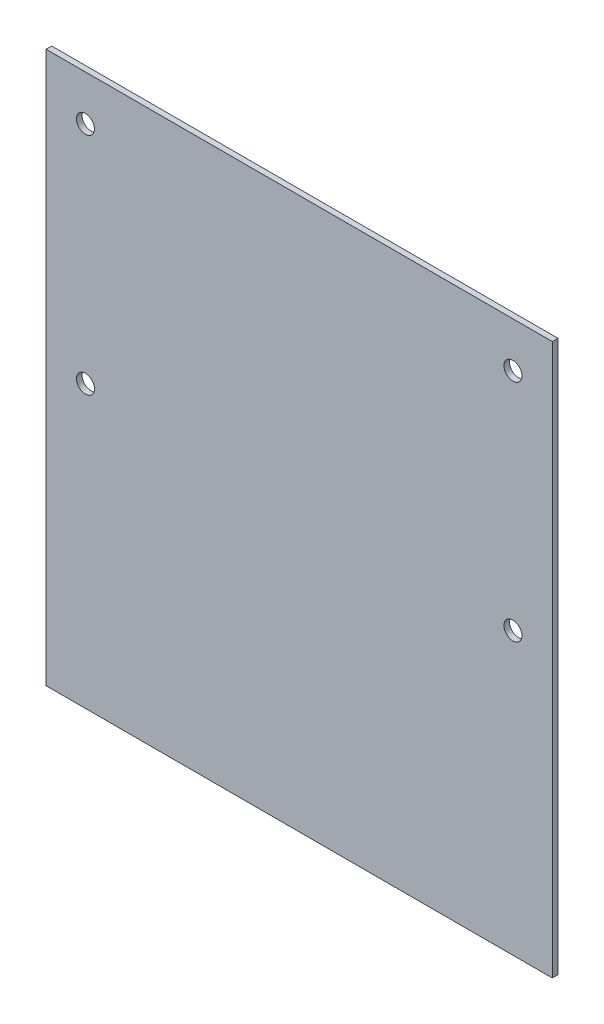
from build123d import *

# Parameters (mm, degrees)
ESQUISSE1_W                  = 90
ESQUISSE1_H                  = 98
BOSS_EXTRU_1_DEPTH           = 1
ENL_V_MAT_EXTRU_1_DEPTH      = 134.06013678
ENL_V_MAT_EXTRU_1_DEPTH_BACK = 134.06013678
ESQUISSE2_R                  = 1.6


with BuildPart() as part:
    # Esquisse1 → Boss.-Extru.1 (new body)
    with BuildSketch(Plane.XY):
        with Locations((45, 49)):
            Rectangle(ESQUISSE1_W, ESQUISSE1_H)
    extrude(amount=BOSS_EXTRU_1_DEPTH)

    # Esquisse2 → Enlèv. mat.-Extru.1 (cut, two sides: drawn at the far end of the back side and taken through both)
    with BuildSketch(Plane.XY.offset(1).offset(-ENL_V_MAT_EXTRU_1_DEPTH_BACK)):
        with Locations((7, 50)):
            Circle(ESQUISSE2_R)
        with Locations((7, 90)):
            Circle(ESQUISSE2_R)
        with Locations(Location((83, 90, 0), (0, 0, 180))):
            Circle(ESQUISSE2_R)
        with Locations(Location((83, 50, 0), (0, 0, 180))):
            Circle(ESQUISSE2_R)
    extrude(amount=ENL_V_MAT_EXTRU_1_DEPTH + ENL_V_MAT_EXTRU_1_DEPTH_BACK, mode=Mode.SUBTRACT)


solid = part.part
